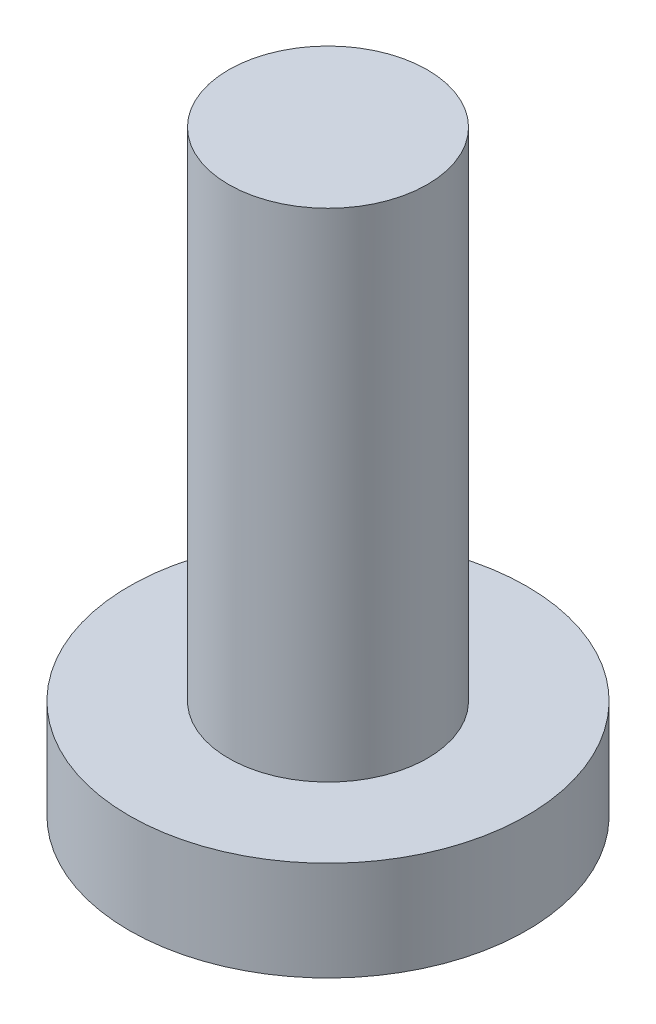
from build123d import *

# Parameters (mm, degrees)
SKETCH2_R           = 1
BOSS_EXTRUDE1_DEPTH = 5
SKETCH3_R           = 2
BOSS_EXTRUDE2_DEPTH = 1


with BuildPart() as part:
    # Sketch2 → Boss-Extrude1 (new body)
    with BuildSketch(Plane(origin=(0, 0, 0), x_dir=(1, 0, 0), z_dir=(0, 1, 0))):
        with Locations(Location((0, 0, 0), (0, 0, 270))):
            Circle(SKETCH2_R)
    extrude(amount=BOSS_EXTRUDE1_DEPTH)

    # Sketch3 → Boss-Extrude2 (add)
    with BuildSketch(Plane.XZ):
        with Locations(Location((0, 0, 0), (0, 0, 270))):
            Circle(SKETCH3_R)
    extrude(amount=BOSS_EXTRUDE2_DEPTH)


solid = part.part
